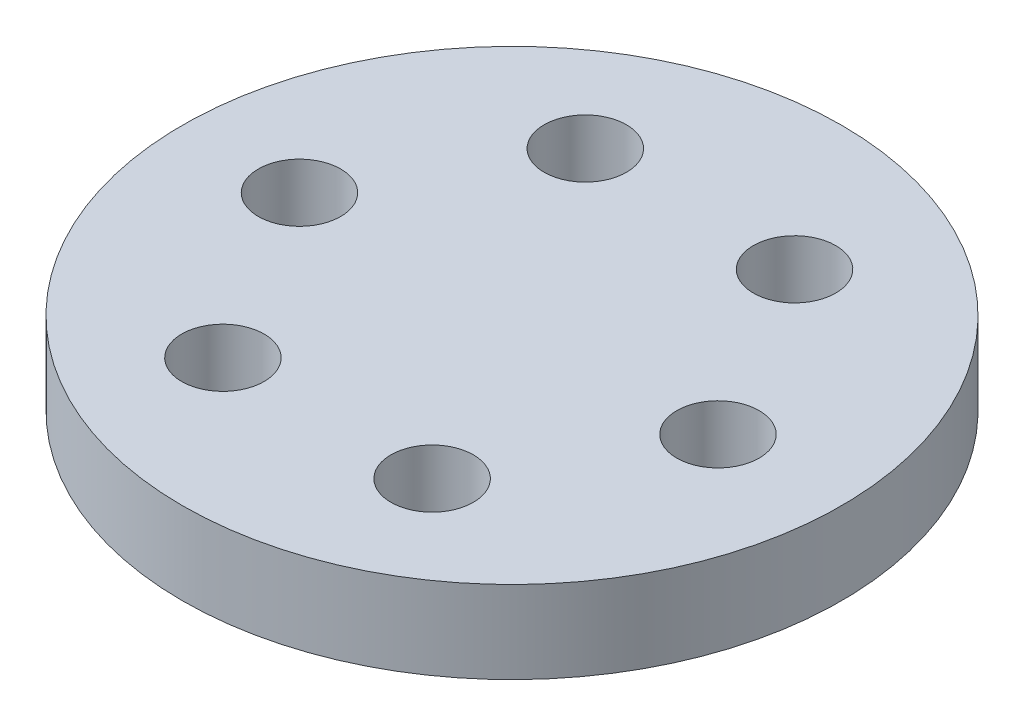
from build123d import *

# Parameters (mm, degrees)
SKETCH1_R           = 40
BOSS_EXTRUDE1_DEPTH = 10
SKETCH2_R           = 5
CUT_EXTRUDE1_DEPTH  = 58.445626465
CIRPATTERN1_COUNT   = 6


with BuildPart() as part:
    # Sketch1 → Boss-Extrude1 (new body)
    with BuildSketch(Plane(origin=(0, 0, 0), x_dir=(1, 0, 0), z_dir=(0, 1, 0))):
        with Locations(Location((0, 0, 0), (0, 0, 270))):
            Circle(SKETCH1_R)
    extrude(amount=BOSS_EXTRUDE1_DEPTH)

    # Sketch2 → Cut-Extrude1 (cut, through all)
    with BuildSketch(Plane(origin=(0, 10, 0), x_dir=(1, 0, 0), z_dir=(0, 1, 0))):
        with Locations(Location((25, 0, 0), (0, 0, 270))):
            Circle(SKETCH2_R)
    cut_extrude1 = extrude(amount=-CUT_EXTRUDE1_DEPTH, mode=Mode.SUBTRACT)

    # CirPattern1: Cut-Extrude1 ×6 about axis
    cirpattern1_axis = Axis((-0.396825397, 0, 0), (0, 1, 0))
    for i in range(1, CIRPATTERN1_COUNT):
        add(cut_extrude1.rotate(cirpattern1_axis, i * 360 / CIRPATTERN1_COUNT), mode=Mode.SUBTRACT)


solid = part.part
